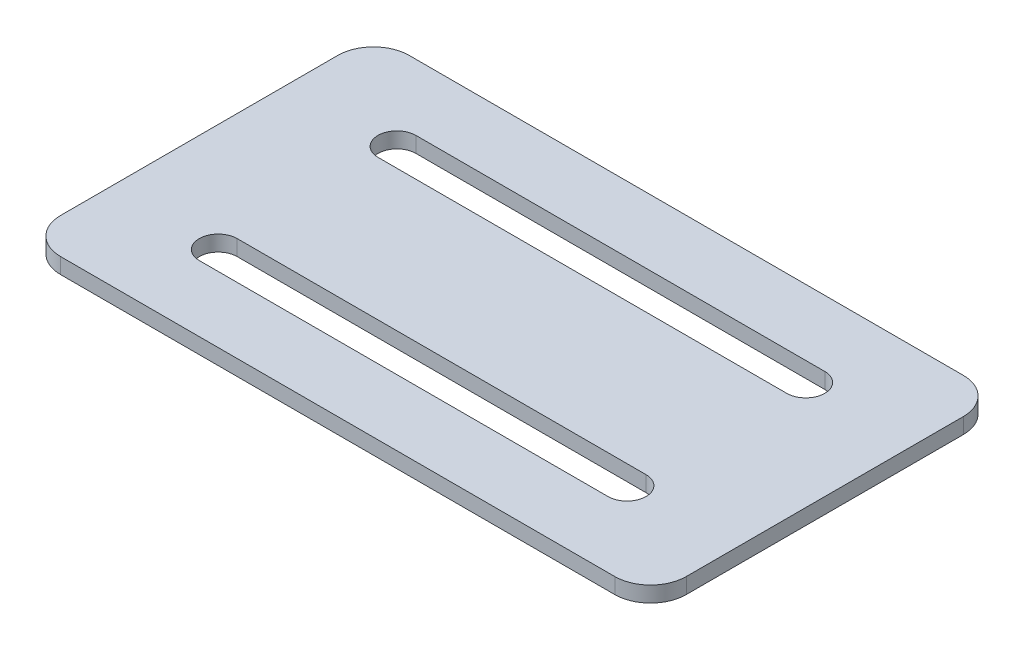
from build123d import *

# Parameters (mm, degrees)
SKETCH1_W           = 78
SKETCH1_H           = 3.498668771
BOSS_EXTRUDE1_DEPTH = 140
FILLET1_R           = 8
CUT_EXTRUDE1_DEPTH  = 10


with BuildPart() as part:
    # Sketch1 → Boss-Extrude1 (new body)
    with BuildSketch(Plane(origin=(468.829800242, 0, 0), x_dir=(0, 0, -1), z_dir=(1, 0, 0))):
        with Locations((-329.624739584, 1.749334386)):
            Rectangle(SKETCH1_W, SKETCH1_H)
    extrude(amount=-BOSS_EXTRUDE1_DEPTH)

    # Fillet1
    fillet1_edges = [part.edges().sort_by_distance(p)[0] for p in [
        (468.829800242, 1.749334385, 290.624739584),
        (328.829800242, 1.749334385, 290.624739584),
        (328.829800242, 1.749334385, 368.624739584),
        (468.829800242, 1.749334385, 368.624739584),
    ]]
    fillet(fillet1_edges, radius=FILLET1_R)

    # Sketch3 → Cut-Extrude1 (cut)
    with BuildSketch(Plane(origin=(0, 3.498668771, 0), x_dir=(1, 0, 0), z_dir=(0, 1, 0))):
        with BuildLine():
            Line((353.079800242, -345.374739584), (444.579800242, -345.374739584))
            ThreePointArc((444.579800242, -345.374739584), (448.829800242, -349.624739584), (444.579800242, -353.874739584))
            Line((444.579800242, -353.874739584), (353.079800242, -353.874739584))
            ThreePointArc((353.079800242, -353.874739584), (348.829800242, -349.624739584), (353.079800242, -345.374739584))
        make_face()
        with BuildLine():
            Line((353.079800242, -305.374739584), (444.579800242, -305.374739584))
            ThreePointArc((444.579800242, -305.374739584), (448.829800242, -309.624739584), (444.579800242, -313.874739584))
            Line((444.579800242, -313.874739584), (353.079800242, -313.874739584))
            ThreePointArc((353.079800242, -313.874739584), (348.829800242, -309.624739584), (353.079800242, -305.374739584))
        make_face()
    extrude(amount=-CUT_EXTRUDE1_DEPTH, mode=Mode.SUBTRACT)


solid = part.part
